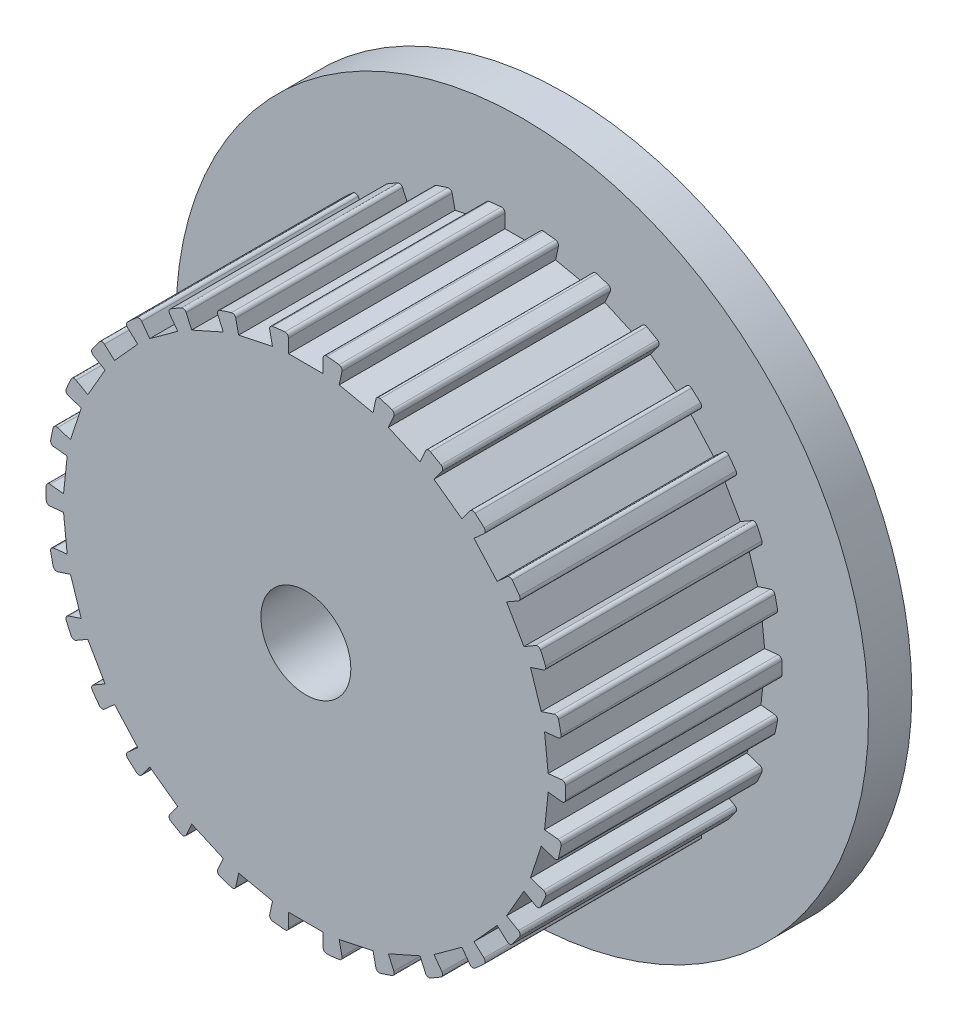
from build123d import *

# Parameters (mm, degrees)
SKETCH1_R                = 12.7
BOSS_EXTRUDE1_DEPTH      = 1.5875
SKETCH2_R                = 9.525
BOSS_EXTRUDE2_DEPTH      = 7.9375
SKETCH3_R                = 1.65
CUT_EXTRUDE1_DEPTH       = 21.329919454
SKETCH4_W                = 1.27
SKETCH4_H                = 0.635
CUT_EXTRUDE2_DEPTH       = 7.9375
FILLET2_R                = 0.127
CIRPATTERN1_COUNT        = 30
FILLET2_OF_CIRPATTERN1_R = 0.127


with BuildPart() as part:
    # Sketch1 → Boss-Extrude1 (new body)
    with BuildSketch(Plane.XY):
        Circle(SKETCH1_R)
    extrude(amount=BOSS_EXTRUDE1_DEPTH)

    # Sketch2 → Boss-Extrude2 (add)
    with BuildSketch(Plane.XY.offset(1.5875)):
        Circle(SKETCH2_R)
    extrude(amount=BOSS_EXTRUDE2_DEPTH)

    # Sketch3 → Cut-Extrude1 (cut, through all)
    with BuildSketch(Plane.XY.offset(9.525)):
        Circle(SKETCH3_R)
    extrude(amount=-CUT_EXTRUDE1_DEPTH, mode=Mode.SUBTRACT)

    # Sketch4 → Cut-Extrude2 (cut)
    with BuildSketch(Plane.XY.offset(9.525)):
        with Locations((0, 9.821309762)):
            Rectangle(SKETCH4_W, SKETCH4_H)
        with Locations((0, 9.186309762)):
            Rectangle(SKETCH4_W, SKETCH4_H)
    cut_extrude2 = extrude(amount=-CUT_EXTRUDE2_DEPTH, mode=Mode.SUBTRACT)

    # Fillet2
    fillet2_edges = [part.edges().sort_by_distance(p)[0] for p in [
        (-0.635, 9.503809762, 5.55625),
        (0.635, 9.503809762, 5.55625),
    ]]
    fillet(fillet2_edges, radius=FILLET2_R)

    # CirPattern1: Cut-Extrude2 ×30 about axis
    cirpattern1_axis = Axis((0, 0, 0), (0, 0, 1))
    for i in range(1, CIRPATTERN1_COUNT):
        add(cut_extrude2.rotate(cirpattern1_axis, i * 360 / CIRPATTERN1_COUNT), mode=Mode.SUBTRACT)

    # Fillet2 of CirPattern1
    fillet2_of_cirpattern1_edges = [part.edges().sort_by_distance(p)[0] for p in [
        (-2.597076883, 9.164104793, 5.55625),
        (-1.35482943, 9.428152641, 5.55625),
        (-4.445649045, 8.42388447, 5.55625),
        (-3.285446314, 8.940440007, 5.55625),
        (-6.09992501, 7.315499974, 5.55625),
        (-5.072473428, 8.061987244, 5.55625),
        (-7.487604982, 5.887393025, 5.55625),
        (-6.637809112, 6.831186953, 5.55625),
        (-8.548040687, 4.20197875, 5.55625),
        (-7.913040687, 5.301831013, 5.55625),
        (-9.234885996, 2.33291784, 5.55625),
        (-8.842434413, 3.540759616, 5.55625),
        (-9.518122472, 0.361897226, 5.55625),
        (-9.385371324, 1.624940033, 5.55625),
        (-9.385371324, -1.624940033, 5.55625),
        (-9.518122472, -0.361897226, 5.55625),
        (-8.842434413, -3.540759616, 5.55625),
        (-9.234885996, -2.33291784, 5.55625),
        (-7.913040687, -5.301831013, 5.55625),
        (-8.548040687, -4.20197875, 5.55625),
        (-6.637809112, -6.831186953, 5.55625),
        (-7.487604982, -5.887393025, 5.55625),
        (-5.072473428, -8.061987244, 5.55625),
        (-6.09992501, -7.315499974, 5.55625),
        (-3.285446314, -8.940440007, 5.55625),
        (-4.445649045, -8.42388447, 5.55625),
        (-1.35482943, -9.428152641, 5.55625),
        (-2.597076883, -9.164104793, 5.55625),
        (0.635, -9.503809762, 5.55625),
        (-0.635, -9.503809762, 5.55625),
        (2.597076883, -9.164104793, 5.55625),
        (1.35482943, -9.428152641, 5.55625),
        (4.445649045, -8.42388447, 5.55625),
        (3.285446314, -8.940440007, 5.55625),
        (6.09992501, -7.315499974, 5.55625),
        (5.072473428, -8.061987244, 5.55625),
        (7.487604982, -5.887393025, 5.55625),
        (6.637809112, -6.831186953, 5.55625),
        (8.548040687, -4.20197875, 5.55625),
        (7.913040687, -5.301831013, 5.55625),
        (9.234885996, -2.33291784, 5.55625),
        (8.842434413, -3.540759616, 5.55625),
        (9.518122472, -0.361897226, 5.55625),
        (9.385371324, -1.624940033, 5.55625),
        (9.385371324, 1.624940033, 5.55625),
        (9.518122472, 0.361897226, 5.55625),
        (8.842434413, 3.540759616, 5.55625),
        (9.234885996, 2.33291784, 5.55625),
        (7.913040687, 5.301831013, 5.55625),
        (8.548040687, 4.20197875, 5.55625),
        (6.637809112, 6.831186953, 5.55625),
        (7.487604982, 5.887393025, 5.55625),
        (5.072473428, 8.061987244, 5.55625),
        (6.09992501, 7.315499974, 5.55625),
        (3.285446314, 8.940440007, 5.55625),
        (4.445649045, 8.42388447, 5.55625),
        (1.35482943, 9.428152641, 5.55625),
        (2.597076883, 9.164104793, 5.55625),
    ]]
    fillet(fillet2_of_cirpattern1_edges, radius=FILLET2_OF_CIRPATTERN1_R)


solid = part.part
